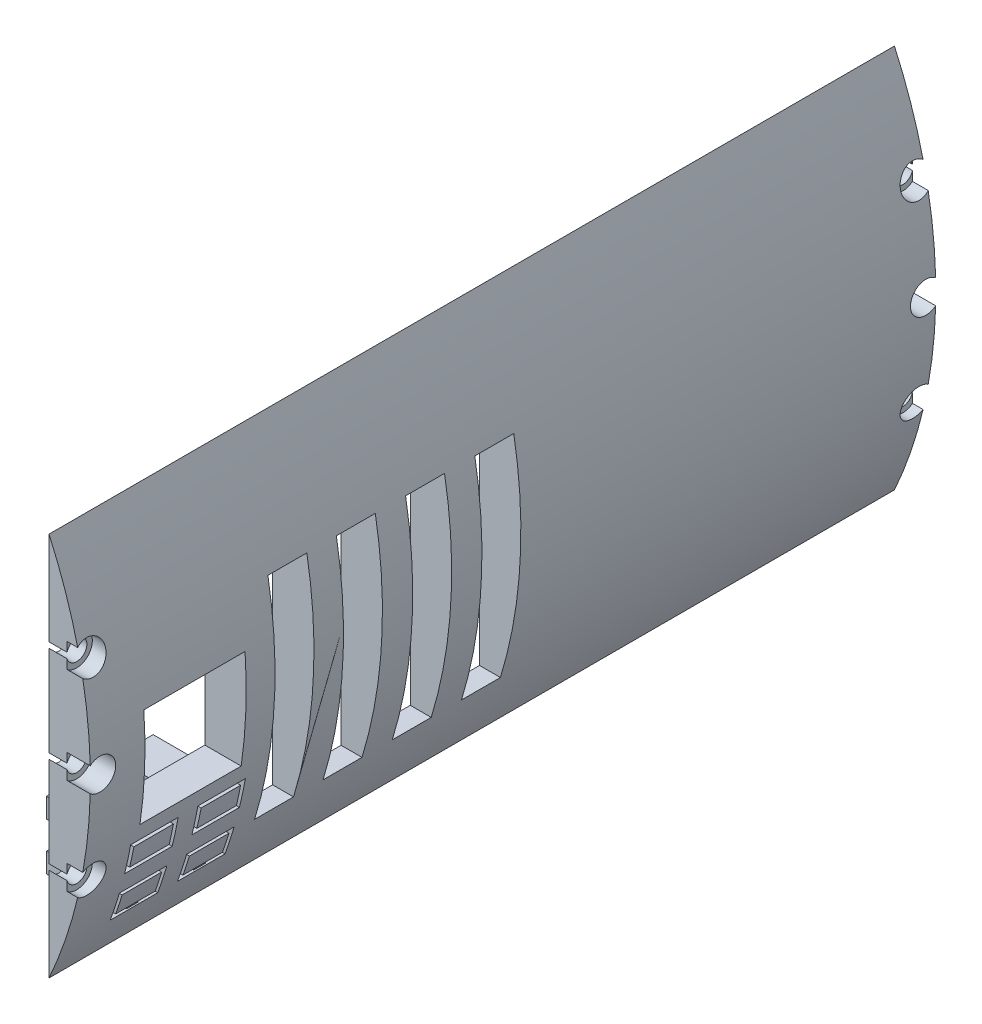
from build123d import *

# Parameters (mm, degrees)
EXTRUDE_1_DEPTH     = 108.58
SKETCH_11_R         = 2
CUT_EXTRUDE_4_DEPTH = 3
SKETCH_12_R         = 1.3
CUT_EXTRUDE_5_DEPTH = 14
SKETCH_15_W         = 13
SKETCH_15_H         = 13
SKETCH_15_W_2       = 5
SKETCH_15_H_2       = 28
CUT_EXTRUDE_6_DEPTH = 10
CUT_EXTRUDE_7_DEPTH = 10
SKETCH_17_W         = 1.5
SKETCH_17_H         = 0.5299964
SKETCH_17_H_2       = 0.5300218
CUT_EXTRUDE_8_DEPTH = 3.813730334
SKETCH_18_W         = 5.08
SKETCH_18_H         = 2.54
EXTRUDE_2_DEPTH     = 7


with BuildPart() as part:
    # 草图3 → 凸台-拉伸1 (new body)
    with BuildSketch(Plane.XY):
        with BuildLine():
            Line((24.686269666, 24.686269666), (24.686269666, -24.686269666))
            ThreePointArc((24.686269666, -24.686269666), (30, 0), (24.686269666, 24.686269666))
        make_face()
    extrude(amount=EXTRUDE_1_DEPTH)

    # 草图11 → 切除-拉伸4 (cut)
    with BuildSketch(Plane(origin=(30, 0, 0), x_dir=(0, 0, -1), z_dir=(1, 0, 0))):
        with Locations((-1.254, -12.343134833)):
            Circle(SKETCH_11_R)
        with Locations((-1.254, 0)):
            Circle(SKETCH_11_R)
        with Locations((-1.254, 12.343134833)):
            Circle(SKETCH_11_R)
        with Locations((-107.33, -12.343134833)):
            Circle(SKETCH_11_R)
        with Locations((-107.33, 0)):
            Circle(SKETCH_11_R)
        with Locations((-107.33, 12.343134833)):
            Circle(SKETCH_11_R)
    extrude(amount=-CUT_EXTRUDE_4_DEPTH, mode=Mode.SUBTRACT)

    # 草图12 → 切除-拉伸5 (cut)
    with BuildSketch(Plane(origin=(27, 0, 0), x_dir=(0, 0, -1), z_dir=(1, 0, 0))):
        with Locations((-1.254, -12.343134833)):
            Circle(SKETCH_12_R)
        with Locations((-1.254, 0)):
            Circle(SKETCH_12_R)
        with Locations((-1.254, 12.343134833)):
            Circle(SKETCH_12_R)
        with Locations((-107.33, 12.343134833)):
            Circle(SKETCH_12_R)
        with Locations((-107.33, 0)):
            Circle(SKETCH_12_R)
        with Locations((-107.33, -12.343134833)):
            Circle(SKETCH_12_R)
    extrude(amount=-CUT_EXTRUDE_5_DEPTH, mode=Mode.SUBTRACT)

    # 草图15 → 切除-拉伸6 (cut)
    with BuildSketch(Plane.ZY.offset(-24.686269666)):
        with Locations((95.066746, -2.286)):
            Rectangle(SKETCH_15_W, SKETCH_15_H)
        with Locations((82.3670381, -3.555929665)):
            Rectangle(SKETCH_15_W_2, SKETCH_15_H_2)
        with Locations((73.5725421, -3.556070335)):
            Rectangle(SKETCH_15_W_2, SKETCH_15_H_2)
        with Locations((64.6825421, -3.555934352)):
            Rectangle(SKETCH_15_W_2, SKETCH_15_H_2)
        with Locations((55.7925421, -3.564457152)):
            Rectangle(SKETCH_15_W_2, SKETCH_15_H_2)
    extrude(amount=-CUT_EXTRUDE_6_DEPTH, mode=Mode.SUBTRACT)

    # 草图16 → 切除-拉伸7 (cut)
    with BuildSketch(Plane.ZY.offset(-24.686269666)):
        Polygon((100.135, -10.7730036), (100.135, -11.303), (101.925, -11.303), (101.925, -13.843), (100.135, -13.843), (100.135, -14.3730218), (102.4349812, -14.3730218), (102.4349812, -10.7730036), align=None)
        Polygon((96.3349934, -10.7730036), (96.3349934, -14.3730218), (98.635, -14.3730218), (98.635, -13.843), (96.845, -13.843), (96.845, -11.303), (98.635, -11.303), (98.635, -10.7730036), align=None)
        Polygon((102.4349812, -16.8690036), (100.135, -16.8690036), (100.135, -17.399), (101.925, -17.399), (101.925, -19.939), (100.135, -19.939), (100.135, -20.4690218), (102.4349812, -20.4690218), align=None)
        Polygon((96.3349934, -16.8690036), (96.3349934, -20.4690218), (98.635, -20.4690218), (98.635, -19.939), (96.845, -19.939), (96.845, -17.399), (98.635, -17.399), (98.635, -16.8690036), align=None)
        Polygon((93.7989812, -10.7730036), (91.499, -10.7730036), (91.499, -11.303), (93.289, -11.303), (93.289, -13.843), (91.499, -13.843), (91.499, -14.3730218), (93.7989812, -14.3730218), align=None)
        Polygon((87.6989934, -10.7730036), (87.6989934, -14.3730218), (89.999, -14.3730218), (89.999, -13.843), (88.209, -13.843), (88.209, -11.303), (89.999, -11.303), (89.999, -10.7730036), align=None)
        Polygon((93.7989812, -16.8690036), (91.499, -16.8690036), (91.499, -17.399), (93.289, -17.399), (93.289, -19.939), (91.499, -19.939), (91.499, -20.4690218), (93.7989812, -20.4690218), align=None)
        Polygon((87.6989934, -16.8690036), (87.6989934, -20.4690218), (89.999, -20.4690218), (89.999, -19.939), (88.209, -19.939), (88.209, -17.399), (89.999, -17.399), (89.999, -16.8690036), align=None)
    extrude(amount=-CUT_EXTRUDE_7_DEPTH, mode=Mode.SUBTRACT)

    # 草图17 → 切除-拉伸8 (cut)
    with BuildSketch(Plane(origin=(30, 0, 0), x_dir=(0, 0, -1), z_dir=(1, 0, 0))):
        with Locations((-99.385, -11.0380018)):
            Rectangle(SKETCH_17_W, SKETCH_17_H)
        with Locations((-99.385, -14.1080109)):
            Rectangle(SKETCH_17_W, SKETCH_17_H_2)
        with Locations((-99.385, -17.1340018)):
            Rectangle(SKETCH_17_W, SKETCH_17_H)
        with Locations((-99.385, -20.2040109)):
            Rectangle(SKETCH_17_W, SKETCH_17_H_2)
        with Locations((-90.749, -17.1340018)):
            Rectangle(SKETCH_17_W, SKETCH_17_H)
        with Locations((-90.749, -20.2040109)):
            Rectangle(SKETCH_17_W, SKETCH_17_H_2)
        with Locations((-90.749, -11.0380018)):
            Rectangle(SKETCH_17_W, SKETCH_17_H)
        with Locations((-90.749, -14.1080109)):
            Rectangle(SKETCH_17_W, SKETCH_17_H_2)
    extrude(amount=-CUT_EXTRUDE_8_DEPTH, mode=Mode.SUBTRACT)

    # 草图18 → 凸台-拉伸2 (add)
    with BuildSketch(Plane.ZY.offset(-24.686269666)):
        with Locations((90.749, -12.573)):
            Rectangle(SKETCH_18_W, SKETCH_18_H)
        with Locations((90.749, -18.669)):
            Rectangle(SKETCH_18_W, SKETCH_18_H)
        with Locations((99.385, -12.573)):
            Rectangle(SKETCH_18_W, SKETCH_18_H)
        with Locations((99.385, -18.669)):
            Rectangle(SKETCH_18_W, SKETCH_18_H)
    extrude(amount=EXTRUDE_2_DEPTH)


solid = part.part
